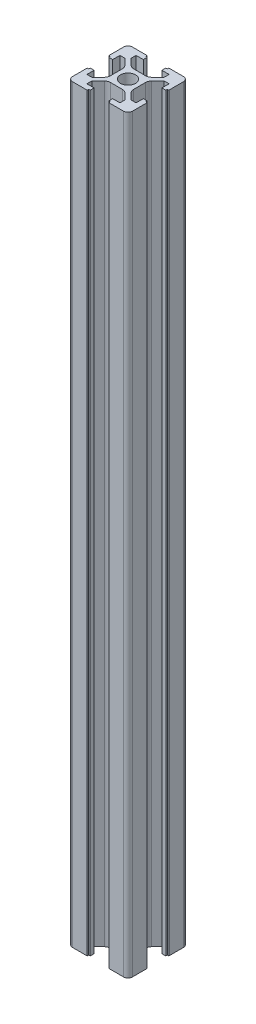
from build123d import *

# Parameters (mm, degrees)
BOSS_EXTRUDE1_DEPTH      = 250
SKETCH4_R                = 2.5
CUT_EXTRUDE2_DEPTH       = 251.399680511
CUT_EXTRUDE1_DEPTH       = 251.399680511
FILLET1_R                = 2
CIRPATTERN1_COUNT        = 4
FILLET1_OF_CIRPATTERN1_R = 2


with BuildPart() as part:
    # Sketch1 → Boss-Extrude1 (new body)
    with BuildSketch(Plane(origin=(0, 0, 0), x_dir=(1, 0, 0), z_dir=(0, 1, 0))):
        with BuildLine():
            Line((8.5, 10), (-8.5, 10))
            ThreePointArc((-8.5, 10), (-9.560660172, 9.560660172), (-10, 8.5))
            Line((-10, 8.5), (-10, -8.5))
            ThreePointArc((-10, -8.5), (-9.560660172, -9.560660172), (-8.5, -10))
            Line((-8.5, -10), (8.5, -10))
            ThreePointArc((8.5, -10), (9.560660172, -9.560660172), (10, -8.5))
            Line((10, -8.5), (10, 8.5))
            ThreePointArc((10, 8.5), (9.560660172, 9.560660172), (8.5, 10))
        make_face()
    extrude(amount=BOSS_EXTRUDE1_DEPTH)

    # Sketch4 → Cut-Extrude2 (cut, through all)
    with BuildSketch(Plane(origin=(0, 0, 0), x_dir=(1, 0, 0), z_dir=(0, 1, 0))):
        with Locations(Location((0, 0, 0), (0, 0, 270))):
            Circle(SKETCH4_R)
    extrude(amount=CUT_EXTRUDE2_DEPTH, mode=Mode.SUBTRACT)

    # Sketch2 → Cut-Extrude1 (cut, through all)
    with BuildSketch(Plane.XZ):
        Polygon((-3.6, -10), (-3.6, -9.5), (-3.1, -9.5), (-3.1, -8.2), (-5.5, -8.2), (-5.5, -6.560660172), (-2.839339828, -3.9), (2.839339828, -3.9), (5.5, -6.560660172), (5.5, -8.2), (3.1, -8.2), (3.1, -9.5), (3.6, -9.5), (3.6, -10), align=None)
    cut_extrude1 = extrude(amount=-CUT_EXTRUDE1_DEPTH, mode=Mode.SUBTRACT)

    # Fillet1
    fillet1_edges = [part.edges().sort_by_distance(p)[0] for p in [
        (-2.839339828, 125, -3.9),
        (2.839339828, 125, -3.9),
    ]]
    fillet(fillet1_edges, radius=FILLET1_R)

    # CirPattern1: Cut-Extrude1 ×4 about axis
    cirpattern1_axis = Axis((0, 0, 0), (0, 1, 0))
    for i in range(1, CIRPATTERN1_COUNT):
        add(cut_extrude1.rotate(cirpattern1_axis, i * 360 / CIRPATTERN1_COUNT), mode=Mode.SUBTRACT)

    # Fillet1 of CirPattern1
    fillet1_of_cirpattern1_edges = [part.edges().sort_by_distance(p)[0] for p in [
        (-3.9, 125, 2.839339828),
        (-3.9, 125, -2.839339828),
        (2.839339828, 125, 3.9),
        (-2.839339828, 125, 3.9),
        (3.9, 125, -2.839339828),
        (3.9, 125, 2.839339828),
    ]]
    fillet(fillet1_of_cirpattern1_edges, radius=FILLET1_OF_CIRPATTERN1_R)


solid = part.part
